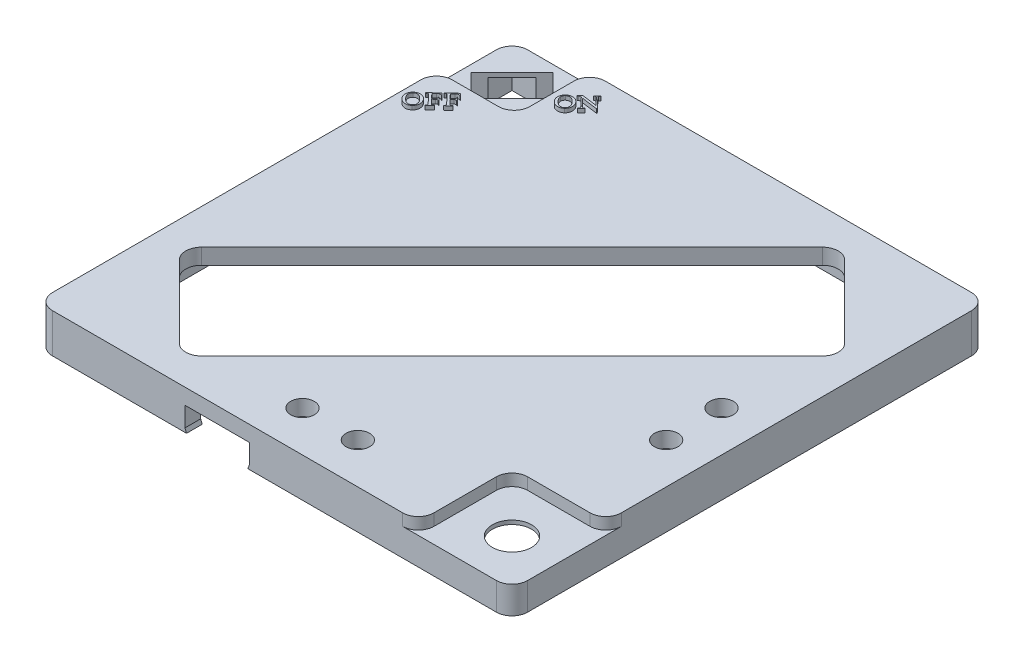
from build123d import *

# Parameters (mm, degrees)
SKETCH3_W           = 60.6
SKETCH3_H           = 60.6
BOSS_EXTRUDE1_DEPTH = 5
CUT_EXTRUDE1_DEPTH  = 44.141395434
SKETCH7_W           = 56.6
SKETCH7_H           = 56.6
CUT_EXTRUDE11_DEPTH = 3
SKETCH9_R           = 1.5
CUT_EXTRUDE12_DEPTH = 43.95555843
SKETCH12_R          = 2.75
CUT_EXTRUDE14_DEPTH = 4.5
SKETCH17_W          = 11.948549902
SKETCH17_H          = 11.948549902
SKETCH17_W_2        = 9.899494937
SKETCH17_H_2        = 9.626613423
CUT_EXTRUDE15_DEPTH = 43.95555843
CUT_EXTRUDE16_REACH = 69.937
SKETCH21_W          = 11.948549902
SKETCH21_H          = 11.948549902
SKETCH21_W_2        = 9.901163731
SKETCH21_H_2        = 9.901163731
BOSS_EXTRUDE2_DEPTH = 0.5
SKETCH22_R          = 2.501188887
CUT_EXTRUDE17_DEPTH = 43.993371582
FILLET3_R           = 2
BOSS_EXTRUDE3_DEPTH = 0.5


with BuildPart() as part:
    # Sketch3 → Boss-Extrude1 (new body)
    with BuildSketch(Plane(origin=(0, 0, 0), x_dir=(1, 0, 0), z_dir=(0, 1, 0))):
        Rectangle(SKETCH3_W, SKETCH3_H)
    extrude(amount=BOSS_EXTRUDE1_DEPTH)

    # Sketch4 → Cut-Extrude1 (cut, through all)
    with BuildSketch(Plane(origin=(0, 5, 0), x_dir=(1, 0, 0), z_dir=(0, 1, 0))):
        Polygon((-15.202795796, -27.223611076), (27.223611076, 15.202795796), (15.202795796, 27.223611076), (-27.223611076, -15.202795796), align=None)
    extrude(amount=-CUT_EXTRUDE1_DEPTH, mode=Mode.SUBTRACT)

    # Sketch7 → Cut-Extrude11 (cut)
    with BuildSketch(Plane.XZ):
        Rectangle(SKETCH7_W, SKETCH7_H)
    extrude(amount=-CUT_EXTRUDE11_DEPTH, mode=Mode.SUBTRACT)

    # Sketch9 → Cut-Extrude12 (cut, through all)
    with BuildSketch(Plane.XZ.offset(-3)):
        with Locations(Location((25.12, -1.6, 0), (0, 0, 270))):
            Circle(SKETCH9_R)
        with Locations(Location((25.12, 5.46, 0), (0, 0, 90))):
            Circle(SKETCH9_R)
        with Locations(Location((5.46, 25.12, 0), (0, 0, 270))):
            Circle(SKETCH9_R)
        with Locations(Location((-1.6, 25.12, 0), (0, 0, 90))):
            Circle(SKETCH9_R)
    extrude(amount=-CUT_EXTRUDE12_DEPTH, mode=Mode.SUBTRACT)

    # Sketch12 → Cut-Extrude14 (cut)
    with BuildSketch(Plane.XZ):
        with Locations(Location((-21.6, -9.72, 0), (0, 0, 270))):
            Circle(SKETCH12_R)
    extrude(amount=-CUT_EXTRUDE14_DEPTH, mode=Mode.SUBTRACT)

    # Sketch17 → Cut-Extrude15 (cut, through all)
    with BuildSketch(Plane.XZ.offset(-3)):
        with Locations((24.325725049, 24.325725049)):
            Rectangle(SKETCH17_W, SKETCH17_H)
        with Locations((-25.350252532, -25.486693288)):
            Rectangle(SKETCH17_W_2, SKETCH17_H_2)
    extrude(amount=-CUT_EXTRUDE15_DEPTH, mode=Mode.SUBTRACT)

    # Sketch20 → Cut-Extrude16 (cut, up to next)
    with BuildSketch(Plane.XY.offset(30.3), mode=Mode.PRIVATE) as cut_extrude16_sk1:
        Polygon((-11.2, 0), (-3.4, 0), (-3.2, 0.5), (-3.2, 3), (-11.4, 3), (-11.4, 0.5), align=None)
    cut_extrude16_tool1 = extrude(cut_extrude16_sk1.sketch, amount=-CUT_EXTRUDE16_REACH, mode=Mode.PRIVATE) & part.part
    add(cut_extrude16_tool1.solids().sort_by_distance((-7.3, 1.505442, 30.3))[0], mode=Mode.SUBTRACT)

    # Sketch21 → Boss-Extrude2 (add)
    with BuildSketch(Plane.XZ.offset(-3)):
        with Locations((24.325725049, 24.325725049)):
            Rectangle(SKETCH21_W, SKETCH21_H)
        with Locations((-25.349418134, -25.349418134)):
            Rectangle(SKETCH21_W_2, SKETCH21_H_2)
    extrude(amount=-BOSS_EXTRUDE2_DEPTH)

    # Sketch22 → Cut-Extrude17 (cut, through all)
    with BuildSketch(Plane(origin=(0, 3.5, 0), x_dir=(1, 0, 0), z_dir=(0, 1, 0))):
        with Locations(Location((24.395658377, -24.395658377, 0), (0, 0, 270))):
            Circle(SKETCH22_R)
        Polygon((-29.387324678, 24.154734498), (-24.154734498, 29.387324678), (-21.313180385, 26.545770566), (-26.545770566, 21.313180385), align=None)
    extrude(amount=-CUT_EXTRUDE17_DEPTH, mode=Mode.SUBTRACT)

    # Fillet3
    fillet3_edges = [part.edges().sort_by_distance(p)[0] for p in [
        (27.223611076, 4, -15.202795796),
        (-15.202795796, 4, 27.223611076),
        (15.202795796, 4, -27.223611076),
        (-27.223611076, 4, 15.202795796),
        (-30.3, 2.5, 30.3),
        (30.3, 2.5, -30.3),
        (30.3, 1.75, 30.3),
        (-30.3, 1.75, -30.3),
        (18.351450098, 4.25, 18.351450098),
        (18.351450098, 4.25, 30.3),
        (30.3, 4.25, 18.351450098),
        (-20.400505063, 4.25, -20.673386577),
        (-20.400505063, 4.25, -30.3),
        (-30.3, 4.25, -20.673386577),
    ]]
    fillet(fillet3_edges, radius=FILLET3_R)

    # Sketch23 → Boss-Extrude3 (add)
    # profile 1 of 5: a face of its own
    with BuildSketch(Plane(origin=(0, 5, 0), x_dir=(1, 0, 0), z_dir=(0, 1, 0))):
        with BuildLine():
            add(Edge.make_bspline(
                [(-28.928166109, 16.336743794), (-28.90425209, 16.357770232), (-28.857057118, 16.399266485), (-28.780047259, 16.452608299), (-28.698949192, 16.496361735), (-28.614277535, 16.532253126), (-28.525203705, 16.557313812), (-28.432600763, 16.57512427), (-28.336023829, 16.583074914), (-28.236807623, 16.582137365), (-28.137265034, 16.572308848), (-28.039641201, 16.553339072), (-27.945369382, 16.52456065), (-27.85473629, 16.486065139), (-27.767333835, 16.438433966), (-27.683393074, 16.381243068), (-27.602667989, 16.314739932), (-27.553159202, 16.264295722), (-27.527992498, 16.238653516)],
                knots=[0, 0, 0, 0, 0.978100523, 1.930308204, 2.871415458, 3.806198986, 4.750452221, 5.709734688, 6.70045807, 7.723183159, 8.755394787, 9.770435649, 10.774706439, 11.778937853, 12.791726501, 13.828906225, 14.896372188, 16, 16, 16, 16], degree=3))
            add(Edge.make_bspline(
                [(-27.527992498, 16.238653516), (-27.503357018, 16.210979803), (-27.455024886, 16.156686988), (-27.391744108, 16.069802536), (-27.338483515, 15.980167106), (-27.295316722, 15.887639125), (-27.261668116, 15.792776487), (-27.237975792, 15.695199936), (-27.224708119, 15.594963684), (-27.22085918, 15.493244233), (-27.226369281, 15.392534929), (-27.241112606, 15.294980193), (-27.264958517, 15.201708281), (-27.298107243, 15.112660857), (-27.340487566, 15.027751645), (-27.392414632, 14.947511006), (-27.45301805, 14.8711054), (-27.499573538, 14.825002392), (-27.523218192, 14.801587544)],
                knots=[0, 0, 0, 0, 1.109186392, 2.176102999, 3.213521787, 4.227370719, 5.229184635, 6.223397968, 7.229027976, 8.252388343, 9.26790266, 10.245355713, 11.202779809, 12.14608785, 13.085936137, 14.039085317, 15.004088446, 16, 16, 16, 16], degree=3))
            add(Edge.make_bspline(
                [(-27.523218192, 14.801587544), (-27.548394262, 14.779204121), (-27.597886866, 14.735201464), (-27.67852688, 14.679307871), (-27.761553246, 14.631666515), (-27.848693897, 14.594862158), (-27.938736104, 14.566661045), (-28.032275243, 14.54916268), (-28.12878106, 14.540317975), (-28.227464497, 14.541458298), (-28.326608496, 14.551341704), (-28.423698963, 14.572779109), (-28.518647854, 14.602436529), (-28.610314106, 14.643329627), (-28.699646002, 14.693414858), (-28.78530578, 14.754427719), (-28.86960695, 14.823812834), (-28.921273154, 14.87687827), (-28.947697359, 14.9040181)],
                knots=[0, 0, 0, 0, 1.01074184, 1.986976042, 2.940204119, 3.880284005, 4.821557656, 5.768149732, 6.732166665, 7.727052563, 8.727349191, 9.718319548, 10.707545748, 11.709284698, 12.726642952, 13.777616877, 14.863382598, 16, 16, 16, 16], degree=3))
            add(Edge.make_bspline(
                [(-28.947697359, 14.9040181), (-28.973450481, 14.932913432), (-29.023871079, 14.989485986), (-29.088364138, 15.080900539), (-29.141755624, 15.175116617), (-29.1841363, 15.272425469), (-29.215657767, 15.372641804), (-29.235628893, 15.475845192), (-29.244677936, 15.581842558), (-29.241724477, 15.653144953), (-29.240232081, 15.68917435)],
                knots=[0, 0, 0, 0, 1.075361515, 2.105390131, 3.103149409, 4.081242847, 5.050580957, 6.017646759, 6.998308666, 8, 8, 8, 8], degree=3))
            add(Edge.make_bspline(
                [(-29.240232081, 15.68917435), (-29.237191433, 15.720360268), (-29.231180791, 15.782007443), (-29.212196032, 15.872280832), (-29.185295819, 15.959098637), (-29.149953337, 16.042185983), (-29.106772311, 16.121789256), (-29.055109186, 16.197370723), (-28.996095071, 16.270106855), (-28.951041198, 16.314303794), (-28.928166109, 16.336743794)],
                knots=[0, 0, 0, 0, 1.020309451, 2.016910081, 2.999442779, 3.977407827, 4.954042781, 5.945076078, 6.9566587, 8, 8, 8, 8], degree=3))
        make_face()
        with BuildLine():
            add(Edge.make_bspline(
                [(-28.875648748, 16.239521572), (-28.89117492, 16.224206604), (-28.921446697, 16.194346616), (-28.960439581, 16.145112584), (-28.992854418, 16.093638962), (-29.01855805, 16.039757514), (-29.03746124, 15.983488459), (-29.049497254, 15.925066114), (-29.055429462, 15.864340085), (-29.053928336, 15.82329636), (-29.053166109, 15.8024556)],
                knots=[0, 0, 0, 0, 1.070344277, 2.086877761, 3.076607634, 4.052388088, 5.011887869, 5.984636453, 6.976659435, 8, 8, 8, 8], degree=3))
            add(Edge.make_bspline(
                [(-29.053166109, 15.8024556), (-29.050520627, 15.775721269), (-29.045141613, 15.721362794), (-29.023943223, 15.640259212), (-28.99508338, 15.55800455), (-28.955754562, 15.475128179), (-28.907477037, 15.391457738), (-28.849626373, 15.306829426), (-28.782341261, 15.22139953), (-28.73218461, 15.166019357), (-28.706377915, 15.137525044)],
                knots=[0, 0, 0, 0, 0.842396573, 1.71283108, 2.623790674, 3.576942379, 4.588385667, 5.654368427, 6.793121156, 8, 8, 8, 8], degree=3))
            add(Edge.make_bspline(
                [(-28.706377915, 15.137525044), (-28.678916455, 15.109140444), (-28.625594835, 15.054026374), (-28.542603089, 14.978875896), (-28.458953847, 14.914294684), (-28.376137602, 14.857888622), (-28.292427885, 14.812437025), (-28.209368044, 14.775404988), (-28.126005385, 14.74823886), (-28.069658479, 14.738039225), (-28.041881387, 14.733011155)],
                knots=[0, 0, 0, 0, 1.195908732, 2.322083053, 3.386924642, 4.394329449, 5.353150995, 6.267367695, 7.145871669, 8, 8, 8, 8], degree=3))
            add(Edge.make_bspline(
                [(-28.041881387, 14.733011155), (-28.021075666, 14.730665264), (-27.980265917, 14.726063874), (-27.919548656, 14.727195996), (-27.860603676, 14.73428545), (-27.803710606, 14.749331119), (-27.748635533, 14.770675816), (-27.695668658, 14.798838373), (-27.644452363, 14.833663154), (-27.613055327, 14.861549035), (-27.597002915, 14.875806294)],
                knots=[0, 0, 0, 0, 1.036364037, 2.032794507, 3.000981362, 3.971076708, 4.940112245, 5.921266466, 6.9372026, 8, 8, 8, 8], degree=3))
            add(Edge.make_bspline(
                [(-27.597002915, 14.875806294), (-27.580722675, 14.891965107), (-27.548777116, 14.923672398), (-27.507767726, 14.976294005), (-27.47352307, 15.031683819), (-27.446704751, 15.090255029), (-27.425804304, 15.151364173), (-27.413115614, 15.215744785), (-27.406561584, 15.282759193), (-27.406929925, 15.352614423), (-27.415508422, 15.42497184), (-27.43429851, 15.49929091), (-27.462220065, 15.575580562), (-27.500631865, 15.653211264), (-27.547606177, 15.733087466), (-27.605174323, 15.813972304), (-27.670955302, 15.897791646), (-27.720608026, 15.951943665), (-27.74630847, 15.979972961)],
                knots=[0, 0, 0, 0, 0.87520199, 1.717346704, 2.540744408, 3.356451598, 4.17232715, 5.001192804, 5.856017749, 6.739981606, 7.663708438, 8.631140434, 9.66058308, 10.760116578, 11.934065898, 13.195457414, 14.548357816, 16, 16, 16, 16], degree=3))
            add(Edge.make_bspline(
                [(-27.74630847, 15.979972961), (-27.774906466, 16.009683707), (-27.830216281, 16.06714563), (-27.916084824, 16.145074128), (-28.000727878, 16.213143555), (-28.084497994, 16.27125118), (-28.167588678, 16.319067034), (-28.250054772, 16.35608362), (-28.331327714, 16.384049747), (-28.386193014, 16.39396816), (-28.412975137, 16.398809766)],
                knots=[0, 0, 0, 0, 1.234112276, 2.386828799, 3.468285477, 4.483339165, 5.435706996, 6.33316462, 7.186345663, 8, 8, 8, 8], degree=3))
            add(Edge.make_bspline(
                [(-28.412975137, 16.398809766), (-28.433926891, 16.401029134), (-28.475335119, 16.405415406), (-28.537301487, 16.403519194), (-28.597809339, 16.394425896), (-28.656710585, 16.37759913), (-28.714402425, 16.354210251), (-28.77010583, 16.32277909), (-28.82487904, 16.285158856), (-28.858464996, 16.25496818), (-28.875648748, 16.239521572)],
                knots=[0, 0, 0, 0, 0.996352815, 1.969152815, 2.925054409, 3.885458765, 4.862107642, 5.864466878, 6.907386425, 8, 8, 8, 8], degree=3))
        make_face(mode=Mode.SUBTRACT)
    # profile 2 of 5: a face of its own
    with BuildSketch(Plane(origin=(0, 5, 0), x_dir=(1, 0, 0), z_dir=(0, 1, 0))):
        with BuildLine():
            Line((-27.595257936, 17.374468281), (-27.060535714, 16.803287725))
            Line((-27.060535714, 16.803287725), (-26.795778769, 17.050683559))
            add(Edge.make_bspline(
                [(-26.795778769, 17.050683559), (-26.781850023, 17.064443909), (-26.755851912, 17.090127707), (-26.72617993, 17.132497536), (-26.706517693, 17.173752723), (-26.699116557, 17.208956535), (-26.699903851, 17.237151194), (-26.703351987, 17.259806319), (-26.71067497, 17.283835838), (-26.720752445, 17.309484776), (-26.733835927, 17.336962133), (-26.750433757, 17.365829917), (-26.770049327, 17.396459055), (-26.784954259, 17.416795789), (-26.792740575, 17.42741967)],
                knots=[0, 0, 0, 0, 1.635053378, 3.051839611, 4.302824522, 5.437338451, 6.018370748, 6.655089809, 7.348304764, 8.114672115, 8.959143028, 9.891327754, 10.898432626, 12, 12, 12, 12], degree=3))
            Line((-26.792740575, 17.42741967), (-26.752810019, 17.464746059))
            Line((-26.752810019, 17.464746059), (-26.292740575, 16.972992587))
            Line((-26.292740575, 16.972992587), (-26.332671131, 16.935666198))
            add(Edge.make_bspline(
                [(-26.332671131, 16.935666198), (-26.34536338, 16.948445297), (-26.368984579, 16.972228128), (-26.404697306, 17.002699248), (-26.437865329, 17.025256697), (-26.469335518, 17.039981331), (-26.499142386, 17.047554361), (-26.527982441, 17.052045934), (-26.556572429, 17.050912641), (-26.5854219, 17.045759267), (-26.61485865, 17.034250306), (-26.645913189, 17.016328043), (-26.679199484, 16.991984099), (-26.70091743, 16.972206123), (-26.712445436, 16.961707864)],
                knots=[0, 0, 0, 0, 1.461234096, 2.7194628, 3.803810603, 4.707463434, 5.521983935, 6.292410237, 7.067652308, 7.832151476, 8.660765653, 9.617542877, 10.735378622, 12, 12, 12, 12], degree=3))
            Line((-26.712445436, 16.961707864), (-26.977202381, 16.714312031))
            Line((-26.977202381, 16.714312031), (-26.550553075, 16.258148837))
            add(Edge.make_bspline(
                [(-26.550553075, 16.258148837), (-26.542187007, 16.24929959), (-26.526300568, 16.232495638), (-26.503135368, 16.208777305), (-26.481637213, 16.187999672), (-26.461585522, 16.17029749), (-26.443757537, 16.15496996), (-26.427819724, 16.142108769), (-26.413123844, 16.132633157), (-26.403735336, 16.127600534), (-26.399511408, 16.125336337)],
                knots=[0, 0, 0, 0, 1.447185851, 2.748080496, 3.939750149, 4.999186033, 5.92602052, 6.734279461, 7.43054725, 8, 8, 8, 8], degree=3))
            add(Edge.make_bspline(
                [(-26.399511408, 16.125336337), (-26.393361981, 16.122911756), (-26.380528909, 16.117851965), (-26.359220654, 16.115166219), (-26.335904815, 16.11606115), (-26.320190047, 16.119566844), (-26.311837797, 16.121430087)],
                knots=[0, 0, 0, 0, 0.883818719, 1.844417125, 2.854328234, 4, 4, 4, 4], degree=3))
            add(Edge.make_bspline(
                [(-26.311837797, 16.121430087), (-26.300136935, 16.124704097), (-26.277193913, 16.131123769), (-26.245266733, 16.146543792), (-26.215253869, 16.164455431), (-26.197769524, 16.179742033), (-26.189007936, 16.187402309)],
                knots=[0, 0, 0, 0, 1.033001334, 2.025506346, 3.010560648, 4, 4, 4, 4], degree=3))
            Line((-26.189007936, 16.187402309), (-26.136490575, 16.236881475))
            Line((-26.136490575, 16.236881475), (-26.099598214, 16.197384948))
            Line((-26.099598214, 16.197384948), (-26.723296131, 15.613617587))
            Line((-26.723296131, 15.613617587), (-26.760188492, 15.653114114))
            Line((-26.760188492, 15.653114114), (-26.708539186, 15.701291198))
            add(Edge.make_bspline(
                [(-26.708539186, 15.701291198), (-26.695118398, 15.715014063), (-26.669769275, 15.740933748), (-26.641978069, 15.784774942), (-26.626648149, 15.830489113), (-26.626844595, 15.861054624), (-26.626941964, 15.876204392)],
                knots=[0, 0, 0, 0, 1.150870878, 2.173759583, 3.094825606, 4, 4, 4, 4], degree=3))
            add(Edge.make_bspline(
                [(-26.626941964, 15.876204392), (-26.627954965, 15.88145086), (-26.630202538, 15.893091337), (-26.637385425, 15.91125649), (-26.648721925, 15.931276494), (-26.662980268, 15.953796831), (-26.681034026, 15.978654595), (-26.70257445, 16.005763215), (-26.728055221, 16.035029), (-26.746529777, 16.054933298), (-26.756282242, 16.065440503)],
                knots=[0, 0, 0, 0, 0.552366717, 1.225550635, 2.009724863, 2.932188954, 3.98386385, 5.188557506, 6.515878141, 8, 8, 8, 8], degree=3))
            Line((-26.756282242, 16.065440503), (-27.634320436, 17.003808559))
            add(Edge.make_bspline(
                [(-27.634320436, 17.003808559), (-27.642510268, 17.012544185), (-27.658257459, 17.029340816), (-27.681692534, 17.052503725), (-27.702970589, 17.073474934), (-27.722366641, 17.091892348), (-27.740466981, 17.106960721), (-27.756851262, 17.119164434), (-27.770818047, 17.129488118), (-27.780239532, 17.134402047), (-27.784494047, 17.136621059)],
                knots=[0, 0, 0, 0, 1.427822853, 2.745380128, 3.928804638, 4.990801047, 5.934044291, 6.734583781, 7.428568655, 8, 8, 8, 8], degree=3))
            add(Edge.make_bspline(
                [(-27.784494047, 17.136621059), (-27.790777575, 17.139229083), (-27.803571301, 17.144539212), (-27.82492553, 17.147110382), (-27.84792634, 17.146859606), (-27.863520605, 17.143564713), (-27.871733631, 17.141829392)],
                knots=[0, 0, 0, 0, 0.91261741, 1.858156392, 2.871955978, 4, 4, 4, 4], degree=3))
            add(Edge.make_bspline(
                [(-27.871733631, 17.141829392), (-27.883128174, 17.138512603), (-27.905725427, 17.131934865), (-27.937577464, 17.116804452), (-27.967500544, 17.098205456), (-27.985208254, 17.082767043), (-27.994129464, 17.074989114)],
                knots=[0, 0, 0, 0, 1.009404637, 2.001815227, 2.993307201, 4, 4, 4, 4], degree=3))
            Line((-27.994129464, 17.074989114), (-28.045778769, 17.026812031))
            Line((-28.045778769, 17.026812031), (-28.083105158, 17.066742587))
            Line((-28.083105158, 17.066742587), (-27.001941964, 18.078461337))
            Line((-27.001941964, 18.078461337), (-26.688573908, 17.772471753))
            Line((-26.688573908, 17.772471753), (-26.726334325, 17.736881475))
            add(Edge.make_bspline(
                [(-26.726334325, 17.736881475), (-26.745860751, 17.748434015), (-26.782431868, 17.770070808), (-26.836114866, 17.79655526), (-26.884726295, 17.815239646), (-26.929244506, 17.826236419), (-26.970757608, 17.830156244), (-27.010590593, 17.828914907), (-27.049631483, 17.822410542), (-27.088798736, 17.809841933), (-27.129476083, 17.789154585), (-27.173984604, 17.75990616), (-27.223279168, 17.721061298), (-27.256630217, 17.690673772), (-27.274511408, 17.674381475)],
                knots=[0, 0, 0, 0, 1.32767869, 2.486614387, 3.499572555, 4.370461477, 5.161703177, 5.932747441, 6.697065723, 7.471034224, 8.330734595, 9.359568396, 10.584330509, 12, 12, 12, 12], degree=3))
            Line((-27.274511408, 17.674381475), (-27.595257936, 17.374468281))
        make_face()
    # profile 3 of 5: a face of its own
    with BuildSketch(Plane(origin=(0, 5, 0), x_dir=(1, 0, 0), z_dir=(0, 1, 0))):
        with BuildLine():
            Line((-26.378637867, 18.513596626), (-25.843915645, 17.94241607))
            Line((-25.843915645, 17.94241607), (-25.579158701, 18.189811904))
            add(Edge.make_bspline(
                [(-25.579158701, 18.189811904), (-25.565229954, 18.203572254), (-25.539231843, 18.229256052), (-25.509559862, 18.27162588), (-25.489897624, 18.312881068), (-25.482496488, 18.348084879), (-25.483283782, 18.376279539), (-25.486731918, 18.398934664), (-25.494054901, 18.422964183), (-25.504132376, 18.448613121), (-25.517215858, 18.476090477), (-25.533813688, 18.504958262), (-25.553429258, 18.535587399), (-25.568334191, 18.555924134), (-25.576120506, 18.566548015)],
                knots=[0, 0, 0, 0, 1.635053378, 3.051839611, 4.302824522, 5.437338451, 6.018370748, 6.655089809, 7.348304764, 8.114672115, 8.959143028, 9.891327754, 10.898432626, 12, 12, 12, 12], degree=3))
            Line((-25.576120506, 18.566548015), (-25.536189951, 18.603874404))
            Line((-25.536189951, 18.603874404), (-25.076120506, 18.112120931))
            Line((-25.076120506, 18.112120931), (-25.116051062, 18.074794542))
            add(Edge.make_bspline(
                [(-25.116051062, 18.074794542), (-25.128743311, 18.087573641), (-25.15236451, 18.111356473), (-25.188077237, 18.141827593), (-25.22124526, 18.164385041), (-25.25271545, 18.179109676), (-25.282522317, 18.186682705), (-25.311362372, 18.191174279), (-25.33995236, 18.190040985), (-25.368801831, 18.184887612), (-25.398238581, 18.173378651), (-25.42929312, 18.155456388), (-25.462579415, 18.131112444), (-25.484297361, 18.111334468), (-25.495825367, 18.100836209)],
                knots=[0, 0, 0, 0, 1.461234096, 2.7194628, 3.803810603, 4.707463434, 5.521983935, 6.292410237, 7.067652308, 7.832151476, 8.660765653, 9.617542877, 10.735378622, 12, 12, 12, 12], degree=3))
            Line((-25.495825367, 18.100836209), (-25.760582312, 17.853440376))
            Line((-25.760582312, 17.853440376), (-25.333933006, 17.397277181))
            add(Edge.make_bspline(
                [(-25.333933006, 17.397277181), (-25.325566938, 17.388427935), (-25.309680499, 17.371623983), (-25.286515299, 17.34790565), (-25.265017144, 17.327128017), (-25.244965453, 17.309425835), (-25.227137468, 17.294098305), (-25.211199655, 17.281237114), (-25.196503775, 17.271761501), (-25.187115267, 17.266728878), (-25.182891339, 17.264464681)],
                knots=[0, 0, 0, 0, 1.447185851, 2.748080496, 3.939750149, 4.999186033, 5.92602052, 6.734279461, 7.43054725, 8, 8, 8, 8], degree=3))
            add(Edge.make_bspline(
                [(-25.182891339, 17.264464681), (-25.176741912, 17.262040101), (-25.16390884, 17.25698031), (-25.142600585, 17.254294563), (-25.119284746, 17.255189495), (-25.103569978, 17.258695189), (-25.095217728, 17.260558431)],
                knots=[0, 0, 0, 0, 0.883818719, 1.844417125, 2.854328234, 4, 4, 4, 4], degree=3))
            add(Edge.make_bspline(
                [(-25.095217728, 17.260558431), (-25.083516866, 17.263832442), (-25.060573845, 17.270252114), (-25.028646664, 17.285672137), (-24.9986338, 17.303583775), (-24.981149455, 17.318870378), (-24.972387867, 17.326530654)],
                knots=[0, 0, 0, 0, 1.033001334, 2.025506346, 3.010560648, 4, 4, 4, 4], degree=3))
            Line((-24.972387867, 17.326530654), (-24.919870506, 17.37600982))
            Line((-24.919870506, 17.37600982), (-24.882978145, 17.336513292))
            Line((-24.882978145, 17.336513292), (-25.506676062, 16.752745931))
            Line((-25.506676062, 16.752745931), (-25.543568423, 16.792242459))
            Line((-25.543568423, 16.792242459), (-25.491919117, 16.840419542))
            add(Edge.make_bspline(
                [(-25.491919117, 16.840419542), (-25.478498329, 16.854142408), (-25.453149206, 16.880062092), (-25.425358, 16.923903287), (-25.41002808, 16.969617458), (-25.410224527, 17.000182969), (-25.410321895, 17.015332737)],
                knots=[0, 0, 0, 0, 1.150870878, 2.173759583, 3.094825606, 4, 4, 4, 4], degree=3))
            add(Edge.make_bspline(
                [(-25.410321895, 17.015332737), (-25.411334896, 17.020579205), (-25.413582469, 17.032219682), (-25.420765356, 17.050384835), (-25.432101856, 17.070404839), (-25.446360199, 17.092925176), (-25.464413957, 17.11778294), (-25.485954381, 17.14489156), (-25.511435152, 17.174157345), (-25.529909708, 17.194061643), (-25.539662173, 17.204568848)],
                knots=[0, 0, 0, 0, 0.552366717, 1.225550635, 2.009724863, 2.932188954, 3.98386385, 5.188557506, 6.515878141, 8, 8, 8, 8], degree=3))
            Line((-25.539662173, 17.204568848), (-26.417700367, 18.142936904))
            add(Edge.make_bspline(
                [(-26.417700367, 18.142936904), (-26.425890199, 18.151672529), (-26.441637391, 18.16846916), (-26.465072465, 18.191632069), (-26.48635052, 18.212603279), (-26.505746572, 18.231020693), (-26.523846912, 18.246089066), (-26.540231193, 18.258292778), (-26.554197978, 18.268616463), (-26.563619463, 18.273530392), (-26.567873978, 18.275749404)],
                knots=[0, 0, 0, 0, 1.427822853, 2.745380128, 3.928804638, 4.990801047, 5.934044291, 6.734583781, 7.428568655, 8, 8, 8, 8], degree=3))
            add(Edge.make_bspline(
                [(-26.567873978, 18.275749404), (-26.574157506, 18.278357428), (-26.586951232, 18.283667557), (-26.608305461, 18.286238727), (-26.631306271, 18.285987951), (-26.646900536, 18.282693057), (-26.655113562, 18.280957737)],
                knots=[0, 0, 0, 0, 0.91261741, 1.858156392, 2.871955978, 4, 4, 4, 4], degree=3))
            add(Edge.make_bspline(
                [(-26.655113562, 18.280957737), (-26.666508106, 18.277640948), (-26.689105358, 18.27106321), (-26.720957396, 18.255932797), (-26.750880475, 18.237333801), (-26.768588186, 18.221895388), (-26.777509395, 18.214117459)],
                knots=[0, 0, 0, 0, 1.009404637, 2.001815227, 2.993307201, 4, 4, 4, 4], degree=3))
            Line((-26.777509395, 18.214117459), (-26.829158701, 18.165940376))
            Line((-26.829158701, 18.165940376), (-26.866485089, 18.205870931))
            Line((-26.866485089, 18.205870931), (-25.785321895, 19.217589681))
            Line((-25.785321895, 19.217589681), (-25.471953839, 18.911600098))
            Line((-25.471953839, 18.911600098), (-25.509714256, 18.87600982))
            add(Edge.make_bspline(
                [(-25.509714256, 18.87600982), (-25.529240682, 18.887562359), (-25.565811799, 18.909199153), (-25.619494797, 18.935683605), (-25.668106226, 18.95436799), (-25.712624437, 18.965364764), (-25.75413754, 18.969284589), (-25.793970524, 18.968043252), (-25.833011414, 18.961538887), (-25.872178667, 18.948970278), (-25.912856014, 18.92828293), (-25.957364535, 18.899034505), (-26.006659099, 18.860189643), (-26.040010148, 18.829802117), (-26.057891339, 18.81350982)],
                knots=[0, 0, 0, 0, 1.32767869, 2.486614387, 3.499572555, 4.370461477, 5.161703177, 5.932747441, 6.697065723, 7.471034224, 8.330734595, 9.359568396, 10.584330509, 12, 12, 12, 12], degree=3))
            Line((-26.057891339, 18.81350982), (-26.378637867, 18.513596626))
        make_face()
    # profile 4 of 5: a face of its own
    with BuildSketch(Plane(origin=(0, 5, 0), x_dir=(1, 0, 0), z_dir=(0, 1, 0))):
        with BuildLine():
            add(Edge.make_bspline(
                [(-18.891050541, 25.734552638), (-18.867136522, 25.755579076), (-18.81994155, 25.797075329), (-18.742931691, 25.850417143), (-18.661833624, 25.894170579), (-18.577161966, 25.93006197), (-18.488088137, 25.955122656), (-18.395485195, 25.972933114), (-18.298908261, 25.980883758), (-18.199692055, 25.979946209), (-18.100149466, 25.970117692), (-18.002525633, 25.951147916), (-17.908253814, 25.922369494), (-17.817620722, 25.883873984), (-17.730218267, 25.836242811), (-17.646277506, 25.779051912), (-17.565552421, 25.712548776), (-17.516043634, 25.662104566), (-17.49087693, 25.63646236)],
                knots=[0, 0, 0, 0, 0.978100523, 1.930308204, 2.871415458, 3.806198986, 4.750452221, 5.709734688, 6.70045807, 7.723183159, 8.755394787, 9.770435649, 10.774706439, 11.778937853, 12.791726501, 13.828906225, 14.896372188, 16, 16, 16, 16], degree=3))
            add(Edge.make_bspline(
                [(-17.49087693, 25.63646236), (-17.466241449, 25.608788647), (-17.417909318, 25.554495832), (-17.35462854, 25.46761138), (-17.301367947, 25.37797595), (-17.258201154, 25.285447969), (-17.224552547, 25.190585331), (-17.200860224, 25.09300878), (-17.187592551, 24.992772528), (-17.183743612, 24.891053077), (-17.189253713, 24.790343773), (-17.203997038, 24.692789037), (-17.227842949, 24.599517125), (-17.260991675, 24.510469702), (-17.303371998, 24.425560489), (-17.355299064, 24.34531985), (-17.415902481, 24.268914244), (-17.46245797, 24.222811236), (-17.486102624, 24.199396388)],
                knots=[0, 0, 0, 0, 1.109186392, 2.176102999, 3.213521787, 4.227370719, 5.229184635, 6.223397968, 7.229027976, 8.252388343, 9.26790266, 10.245355713, 11.202779809, 12.14608785, 13.085936137, 14.039085317, 15.004088446, 16, 16, 16, 16], degree=3))
            add(Edge.make_bspline(
                [(-17.486102624, 24.199396388), (-17.511278693, 24.177012965), (-17.560771298, 24.133010308), (-17.641411311, 24.077116715), (-17.724437678, 24.029475359), (-17.811578329, 23.992671002), (-17.901620535, 23.964469889), (-17.995159675, 23.946971524), (-18.091665491, 23.938126819), (-18.190348929, 23.939267142), (-18.289492928, 23.949150548), (-18.386583395, 23.970587954), (-18.481532286, 24.000245373), (-18.573198538, 24.041138471), (-18.662530434, 24.091223702), (-18.748190212, 24.152236564), (-18.832491381, 24.221621678), (-18.884157586, 24.274687115), (-18.910581791, 24.301826944)],
                knots=[0, 0, 0, 0, 1.01074184, 1.986976042, 2.940204119, 3.880284005, 4.821557656, 5.768149732, 6.732166665, 7.727052563, 8.727349191, 9.718319548, 10.707545748, 11.709284698, 12.726642952, 13.777616877, 14.863382598, 16, 16, 16, 16], degree=3))
            add(Edge.make_bspline(
                [(-18.910581791, 24.301826944), (-18.936334913, 24.330722276), (-18.986755511, 24.387294831), (-19.051248569, 24.478709383), (-19.104640056, 24.572925461), (-19.147020731, 24.670234314), (-19.178542199, 24.770450648), (-19.198513325, 24.873654037), (-19.207562368, 24.979651403), (-19.204608908, 25.050953797), (-19.203116513, 25.086983194)],
                knots=[0, 0, 0, 0, 1.075361515, 2.105390131, 3.103149409, 4.081242847, 5.050580957, 6.017646759, 6.998308666, 8, 8, 8, 8], degree=3))
            add(Edge.make_bspline(
                [(-19.203116513, 25.086983194), (-19.200075865, 25.118169113), (-19.194065223, 25.179816287), (-19.175080464, 25.270089676), (-19.14818025, 25.356907481), (-19.112837769, 25.439994827), (-19.069656743, 25.5195981), (-19.017993618, 25.595179567), (-18.958979503, 25.667915699), (-18.913925629, 25.712112638), (-18.891050541, 25.734552638)],
                knots=[0, 0, 0, 0, 1.020309451, 2.016910081, 2.999442779, 3.977407827, 4.954042781, 5.945076078, 6.9566587, 8, 8, 8, 8], degree=3))
        make_face()
        with BuildLine():
            add(Edge.make_bspline(
                [(-18.83853318, 25.637330416), (-18.854059352, 25.622015448), (-18.884331128, 25.592155461), (-18.923324013, 25.542921428), (-18.955738849, 25.491447806), (-18.981442482, 25.437566358), (-19.000345672, 25.381297303), (-19.012381686, 25.322874958), (-19.018313894, 25.262148929), (-19.016812767, 25.221105204), (-19.016050541, 25.200264444)],
                knots=[0, 0, 0, 0, 1.070344277, 2.086877761, 3.076607634, 4.052388088, 5.011887869, 5.984636453, 6.976659435, 8, 8, 8, 8], degree=3))
            add(Edge.make_bspline(
                [(-19.016050541, 25.200264444), (-19.013405059, 25.173530113), (-19.008026045, 25.119171638), (-18.986827655, 25.038068056), (-18.957967812, 24.955813394), (-18.918638994, 24.872937024), (-18.870361469, 24.789266582), (-18.812510805, 24.70463827), (-18.745225693, 24.619208374), (-18.695069042, 24.563828201), (-18.669262346, 24.535333888)],
                knots=[0, 0, 0, 0, 0.842396573, 1.71283108, 2.623790674, 3.576942379, 4.588385667, 5.654368427, 6.793121156, 8, 8, 8, 8], degree=3))
            add(Edge.make_bspline(
                [(-18.669262346, 24.535333888), (-18.641800887, 24.506949288), (-18.588479267, 24.451835218), (-18.505487521, 24.37668474), (-18.421838278, 24.312103528), (-18.339022033, 24.255697466), (-18.255312317, 24.210245869), (-18.172252475, 24.173213832), (-18.088889816, 24.146047704), (-18.032542911, 24.135848069), (-18.004765819, 24.130819999)],
                knots=[0, 0, 0, 0, 1.195908732, 2.322083053, 3.386924642, 4.394329449, 5.353150995, 6.267367695, 7.145871669, 8, 8, 8, 8], degree=3))
            add(Edge.make_bspline(
                [(-18.004765819, 24.130819999), (-17.983960098, 24.128474108), (-17.943150349, 24.123872718), (-17.882433088, 24.12500484), (-17.823488107, 24.132094294), (-17.766595037, 24.147139963), (-17.711519965, 24.168484661), (-17.658553089, 24.196647217), (-17.607336795, 24.231471998), (-17.575939759, 24.259357879), (-17.559887346, 24.273615138)],
                knots=[0, 0, 0, 0, 1.036364037, 2.032794507, 3.000981362, 3.971076708, 4.940112245, 5.921266466, 6.9372026, 8, 8, 8, 8], degree=3))
            add(Edge.make_bspline(
                [(-17.559887346, 24.273615138), (-17.543607107, 24.289773951), (-17.511661548, 24.321481242), (-17.470652158, 24.374102849), (-17.436407502, 24.429492663), (-17.409589183, 24.488063873), (-17.388688735, 24.549173017), (-17.376000046, 24.613553629), (-17.369446016, 24.680568038), (-17.369814357, 24.750423267), (-17.378392854, 24.822780684), (-17.397182942, 24.897099754), (-17.425104497, 24.973389406), (-17.463516297, 25.051020108), (-17.510490609, 25.13089631), (-17.568058755, 25.211781148), (-17.633839734, 25.295600491), (-17.683492458, 25.349752509), (-17.709192902, 25.377781805)],
                knots=[0, 0, 0, 0, 0.87520199, 1.717346704, 2.540744408, 3.356451598, 4.17232715, 5.001192804, 5.856017749, 6.739981606, 7.663708438, 8.631140434, 9.66058308, 10.760116578, 11.934065898, 13.195457414, 14.548357816, 16, 16, 16, 16], degree=3))
            add(Edge.make_bspline(
                [(-17.709192902, 25.377781805), (-17.737790898, 25.407492551), (-17.793100713, 25.464954474), (-17.878969256, 25.542882973), (-17.96361231, 25.610952399), (-18.047382426, 25.669060024), (-18.13047311, 25.716875878), (-18.212939204, 25.753892464), (-18.294212146, 25.781858591), (-18.349077446, 25.791777004), (-18.375859569, 25.79661861)],
                knots=[0, 0, 0, 0, 1.234112276, 2.386828799, 3.468285477, 4.483339165, 5.435706996, 6.33316462, 7.186345663, 8, 8, 8, 8], degree=3))
            add(Edge.make_bspline(
                [(-18.375859569, 25.79661861), (-18.396811322, 25.798837978), (-18.438219551, 25.80322425), (-18.500185919, 25.801328038), (-18.56069377, 25.79223474), (-18.619595017, 25.775407974), (-18.677286857, 25.752019095), (-18.732990262, 25.720587934), (-18.787763472, 25.6829677), (-18.821349428, 25.652777024), (-18.83853318, 25.637330416)],
                knots=[0, 0, 0, 0, 0.996352815, 1.969152815, 2.925054409, 3.885458765, 4.862107642, 5.864466878, 6.907386425, 8, 8, 8, 8], degree=3))
        make_face(mode=Mode.SUBTRACT)
    # profile 5 of 5: a face of its own
    with BuildSketch(Plane(origin=(0, 5, 0), x_dir=(1, 0, 0), z_dir=(0, 1, 0))):
        with BuildLine():
            Line((-18.110225701, 26.40422157), (-17.715694451, 26.773579208))
            Line((-17.715694451, 26.773579208), (-15.80770834, 26.514898653))
            Line((-15.80770834, 26.514898653), (-16.591562507, 27.352572264))
            add(Edge.make_bspline(
                [(-16.591562507, 27.352572264), (-16.601611919, 27.363208868), (-16.620655729, 27.383365416), (-16.648990415, 27.410934363), (-16.675445717, 27.434276202), (-16.699587134, 27.454153124), (-16.722229329, 27.46938003), (-16.742632132, 27.480804109), (-16.761038381, 27.48887202), (-16.773073933, 27.490940536), (-16.778628479, 27.491895181)],
                knots=[0, 0, 0, 0, 1.483230272, 2.810746905, 4.005499274, 5.059058418, 5.978307079, 6.766014433, 7.430501398, 8, 8, 8, 8], degree=3))
            add(Edge.make_bspline(
                [(-16.778628479, 27.491895181), (-16.792321593, 27.492040443), (-16.820610098, 27.492340541), (-16.863173664, 27.478248124), (-16.906111566, 27.454347172), (-16.931961418, 27.431552887), (-16.945729173, 27.419412542)],
                knots=[0, 0, 0, 0, 0.871370642, 1.800158322, 2.828353789, 4, 4, 4, 4], degree=3))
            Line((-16.945729173, 27.419412542), (-16.996076396, 27.372103514))
            Line((-16.996076396, 27.372103514), (-17.033402785, 27.41203407))
            Line((-17.033402785, 27.41203407), (-16.527326396, 27.885558375))
            Line((-16.527326396, 27.885558375), (-16.490000007, 27.84562782))
            Line((-16.490000007, 27.84562782), (-16.541649312, 27.797450736))
            add(Edge.make_bspline(
                [(-16.541649312, 27.797450736), (-16.555497093, 27.783528488), (-16.581464975, 27.757420961), (-16.608177238, 27.712079449), (-16.623020605, 27.665672157), (-16.621139025, 27.634779683), (-16.62020834, 27.619499347)],
                knots=[0, 0, 0, 0, 1.161011364, 2.177172422, 3.098375311, 4, 4, 4, 4], degree=3))
            add(Edge.make_bspline(
                [(-16.62020834, 27.619499347), (-16.619048153, 27.61439191), (-16.616534647, 27.603326821), (-16.609135065, 27.586189415), (-16.598594378, 27.567073616), (-16.584518946, 27.545957977), (-16.567557743, 27.522410496), (-16.547182184, 27.496876605), (-16.523131916, 27.469642503), (-16.505947266, 27.45092158), (-16.496944451, 27.441113931)],
                knots=[0, 0, 0, 0, 0.572911384, 1.241193098, 2.035751238, 2.963533685, 4.019525564, 5.215362592, 6.541164616, 8, 8, 8, 8], degree=3))
            Line((-16.496944451, 27.441113931), (-15.351111118, 26.21672157))
            Line((-15.351111118, 26.21672157), (-15.38973959, 26.180263236))
            Line((-15.38973959, 26.180263236), (-17.442690979, 26.454134764))
            Line((-17.442690979, 26.454134764), (-16.605451396, 25.559169486))
            add(Edge.make_bspline(
                [(-16.605451396, 25.559169486), (-16.595361257, 25.548716597), (-16.576105359, 25.528768429), (-16.548161244, 25.500980189), (-16.522008214, 25.477279391), (-16.4977391, 25.457829158), (-16.475809721, 25.441853157), (-16.455463402, 25.430553586), (-16.437498424, 25.421995601), (-16.425539796, 25.419919267), (-16.420121535, 25.418978514)],
                knots=[0, 0, 0, 0, 1.479429333, 2.823325044, 4.012561858, 5.070949442, 5.990642714, 6.769101302, 7.442299669, 8, 8, 8, 8], degree=3))
            add(Edge.make_bspline(
                [(-16.420121535, 25.418978514), (-16.406119305, 25.418759371), (-16.377459786, 25.418310832), (-16.334917062, 25.433273416), (-16.291809875, 25.456293984), (-16.266189052, 25.478981954), (-16.252586812, 25.491027125)],
                knots=[0, 0, 0, 0, 0.889049664, 1.819691419, 2.842461899, 4, 4, 4, 4], degree=3))
            Line((-16.252586812, 25.491027125), (-16.200937507, 25.539638236))
            Line((-16.200937507, 25.539638236), (-16.164045146, 25.500141708))
            Line((-16.164045146, 25.500141708), (-16.669687507, 25.026617403))
            Line((-16.669687507, 25.026617403), (-16.706579868, 25.066113931))
            Line((-16.706579868, 25.066113931), (-16.656232646, 25.113422958))
            add(Edge.make_bspline(
                [(-16.656232646, 25.113422958), (-16.642274545, 25.127508813), (-16.616173989, 25.15384826), (-16.588690943, 25.199209194), (-16.573938912, 25.245957605), (-16.57615055, 25.276970999), (-16.57723959, 25.292242403)],
                knots=[0, 0, 0, 0, 1.165913306, 2.180166746, 3.103890141, 4, 4, 4, 4], degree=3))
            add(Edge.make_bspline(
                [(-16.57723959, 25.292242403), (-16.578416668, 25.297342617), (-16.580996957, 25.308522862), (-16.588151912, 25.325916059), (-16.599064242, 25.345024322), (-16.612122189, 25.366701591), (-16.629669626, 25.389763775), (-16.649801774, 25.415191013), (-16.673430119, 25.442676436), (-16.690604402, 25.461279505), (-16.699635423, 25.471061847)],
                knots=[0, 0, 0, 0, 0.573171155, 1.256455898, 2.051374308, 2.984442828, 4.028097173, 5.22447642, 6.540503149, 8, 8, 8, 8], degree=3))
            Line((-16.699635423, 25.471061847), (-17.644947923, 26.481478514))
            add(Edge.make_bspline(
                [(-17.644947923, 26.481478514), (-17.66547549, 26.48368091), (-17.703152326, 26.487723245), (-17.755011939, 26.490812378), (-17.797011961, 26.491498648), (-17.831706591, 26.489775826), (-17.862966513, 26.483192884), (-17.895616414, 26.474254391), (-17.931381707, 26.460305212), (-17.956055563, 26.449190283), (-17.969166673, 26.44328407)],
                knots=[0, 0, 0, 0, 1.489694949, 2.734225314, 3.746977689, 4.521313386, 5.233851665, 6.04698106, 6.96221137, 8, 8, 8, 8], degree=3))
            add(Edge.make_bspline(
                [(-17.969166673, 26.44328407), (-17.976504939, 26.439400954), (-17.992655677, 26.430854634), (-18.016692095, 26.412810145), (-18.044243023, 26.390737815), (-18.062882038, 26.373535926), (-18.072899312, 26.364291014)],
                knots=[0, 0, 0, 0, 0.760645241, 1.6740987, 2.749977284, 4, 4, 4, 4], degree=3))
            Line((-18.072899312, 26.364291014), (-18.110225701, 26.40422157))
        make_face()
    extrude(amount=BOSS_EXTRUDE3_DEPTH)


solid = part.part
